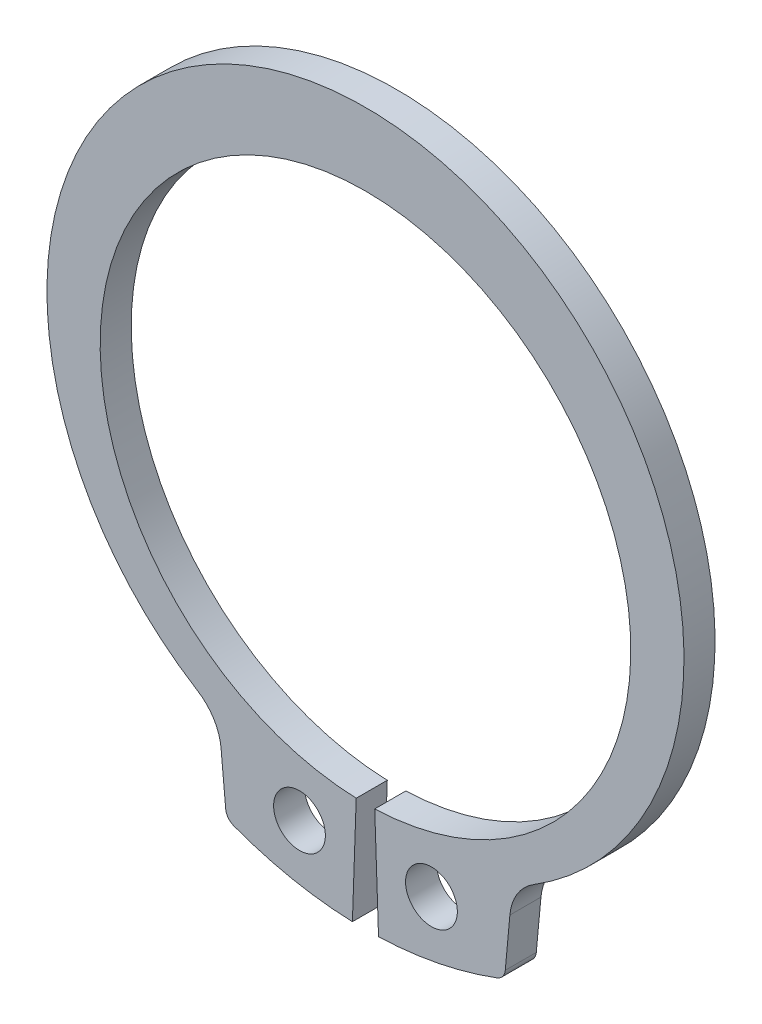
from build123d import *

# Parameters (mm, degrees)
SKETCH4_R           = 1
BOSS_EXTRUDE1_DEPTH = 0.6
FILLET1_R           = 1.945085901
FILLET2_R           = 0.486271475


with BuildPart() as part:
    # Sketch4 → Boss-Extrude1 (new, symmetric)
    with BuildSketch(Plane.XY):
        with BuildLine():
            Line((-5.372687964, -13.423537178), (-5.671299881, -10.17638726))
            ThreePointArc((-5.671299881, -10.17638726), (-11.954378983, 3.663370767), (0, 13.05))
            Line((0, 13.05), (0, 10.25))
            ThreePointArc((0, 10.25), (-10.248438875, 0.178887166), (-0.357719841, -10.243755977))
            Line((-0.357719841, -10.243755977), (-0.504605119, -14.45))
            ThreePointArc((-0.504605119, -14.45), (-2.98312755, -14.147723363), (-5.372687964, -13.423537178))
        make_face()
        with Locations((-2.548948919, -12.088596137)):
            Circle(SKETCH4_R, mode=Mode.SUBTRACT)
    extrude(amount=BOSS_EXTRUDE1_DEPTH, both=True)

    # Fillet1
    fillet1_edges = [part.edges().sort_by_distance(p)[0] for p in [
        (-5.671299881, -10.17638726, 0),
    ]]
    fillet(fillet1_edges, radius=FILLET1_R)

    # Fillet2
    fillet2_edges = [part.edges().sort_by_distance(p)[0] for p in [
        (-5.372687964, -13.423537178, 0),
    ]]
    fillet(fillet2_edges, radius=FILLET2_R)

    # Mirror1: part across plane


with BuildPart() as part_1:
    add(part.part)
    add(part.part.mirror(Plane(origin=(0, 13.05, 0.6), x_dir=(0, 0, 1), z_dir=(-1, 0, 0))))


solid = part_1.part
